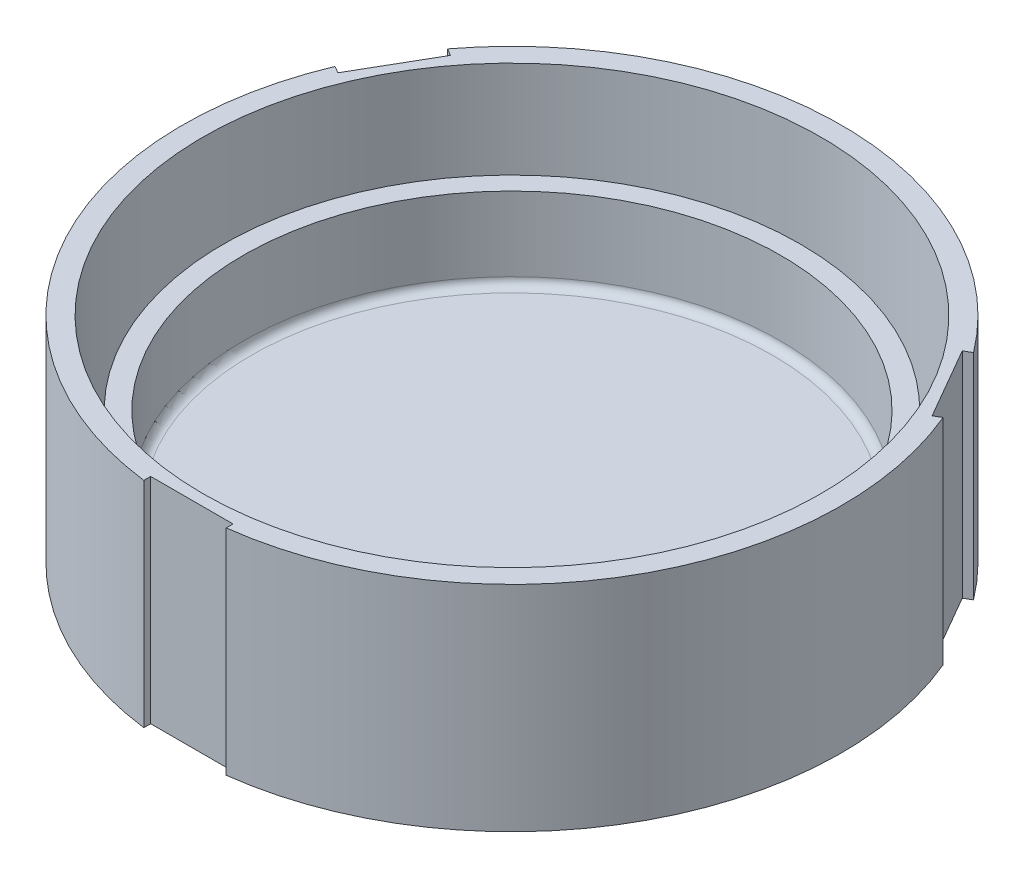
from build123d import *

# Parameters (mm, degrees)
SZKIC2_R                    = 80
DODANIE_WYCI_GNI_CIE1_DEPTH = 52
SZKIC3_R                    = 75
WYTNIJ_WYCI_GNI_CIE1_DEPTH  = 40
SZKIC4_R                    = 70
SZKIC4_R_2                  = 65.25
DODANIE_WYCI_GNI_CIE3_DEPTH = 20
ZAOKR_GLENIE4_R             = 2
ZAOKR_GLENIE5_R             = 2
SZKIC5_W                    = 20
SZKIC5_H                    = 20
WYTNIJ_WYCI_GNI_CIE3_DEPTH  = 125.51505933


with BuildPart() as part:
    # Szkic2 → Dodanie-wyciągnięcie1 (new body)
    with BuildSketch(Plane(origin=(0, 0, 0), x_dir=(1, 0, 0), z_dir=(0, 1, 0))):
        with Locations(Location((0, 0, 0), (0, 0, 90))):
            Circle(SZKIC2_R)
    extrude(amount=DODANIE_WYCI_GNI_CIE1_DEPTH)

    # Szkic3 → Wytnij-wyciągnięcie1 (cut)
    with BuildSketch(Plane(origin=(0, 52, 0), x_dir=(1, 0, 0), z_dir=(0, 1, 0))):
        with Locations(Location((0, 0, 0), (0, 0, 270))):
            Circle(SZKIC3_R)
    extrude(amount=-WYTNIJ_WYCI_GNI_CIE1_DEPTH, mode=Mode.SUBTRACT)

    # Szkic4 → Dodanie-wyciągnięcie3 (add)
    with BuildSketch(Plane(origin=(0, 12, 0), x_dir=(1, 0, 0), z_dir=(0, 1, 0))):
        with Locations(Location((0, 0, 0), (0, 0, 270))):
            Circle(SZKIC4_R)
        with Locations(Location((0, 0, 0), (0, 0, 270))):
            Circle(SZKIC4_R_2, mode=Mode.SUBTRACT)
    extrude(amount=DODANIE_WYCI_GNI_CIE3_DEPTH)

    # Zaokrąglenie4
    zaokr_glenie4_edges = [part.edges().sort_by_distance(p)[0] for p in [
        (0, 12, -65.25),
    ]]
    fillet(zaokr_glenie4_edges, radius=ZAOKR_GLENIE4_R)

    # Zaokrąglenie5
    zaokr_glenie5_edges = [part.edges().sort_by_distance(p)[0] for p in [
        (0, 12, -70),
        (0, 12, -75),
    ]]
    fillet(zaokr_glenie5_edges, radius=ZAOKR_GLENIE5_R)

    # Szkic5 → Wytnij-wyciągnięcie3 (cut, through all)
    with BuildSketch(Plane.XZ):
        Polygon((72.116968793, -29.879745962), (89.437476869, -39.879745962), (79.437476869, -57.200254038), (62.116968793, -47.200254038), align=None)
        with Locations((0, 87.71)):
            Rectangle(SZKIC5_W, SZKIC5_H)
        Polygon((-62.116968793, -47.200254038), (-79.437476869, -57.200254038), (-89.437476869, -39.879745962), (-72.116968793, -29.879745962), align=None)
    extrude(amount=-WYTNIJ_WYCI_GNI_CIE3_DEPTH, mode=Mode.SUBTRACT)


solid = part.part
